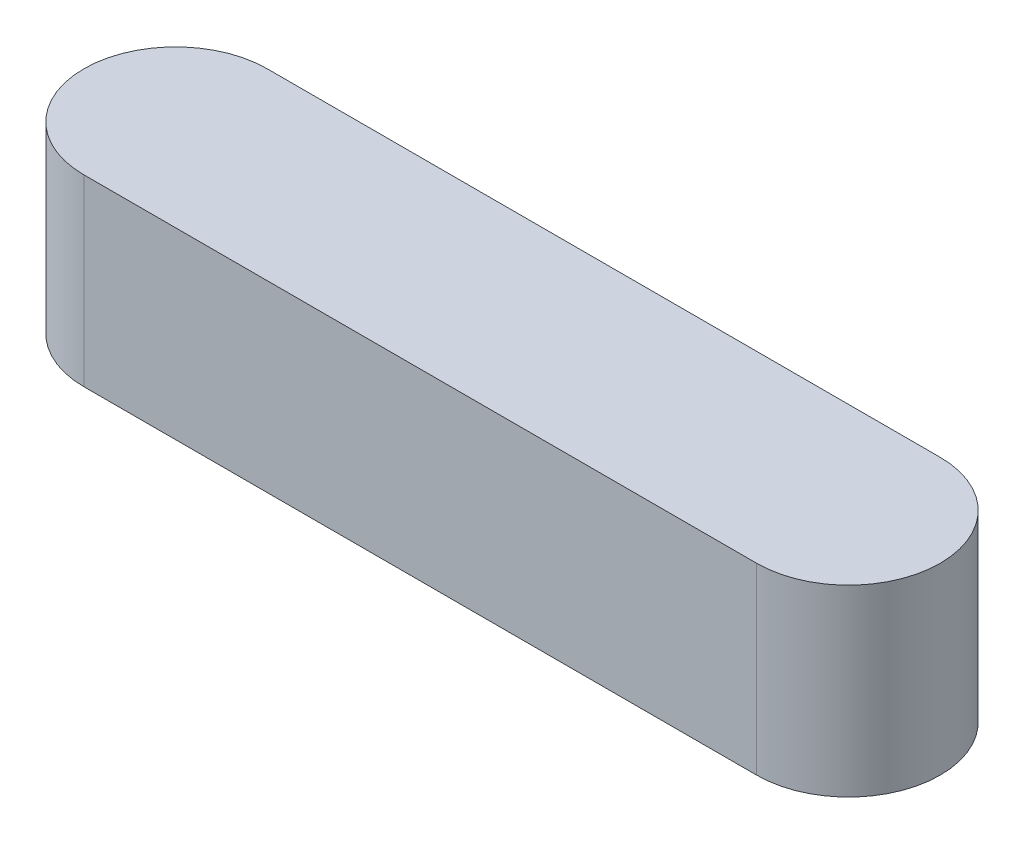
from build123d import *

# Parameters (mm, degrees)
EXTRUDE_1_DEPTH = 6


with BuildPart() as part:
    # Эскиз1 → Бобышка-Вытянуть1 (new body)
    with BuildSketch(Plane(origin=(0, 0, 0), x_dir=(1, 0, 0), z_dir=(0, 1, 0))):
        with BuildLine():
            Line((0, 3), (22, 3))
            ThreePointArc((22, 3), (25, 0), (22, -3))
            Line((22, -3), (0, -3))
            ThreePointArc((0, -3), (-3, 0), (0, 3))
        make_face()
    extrude(amount=EXTRUDE_1_DEPTH)


solid = part.part
